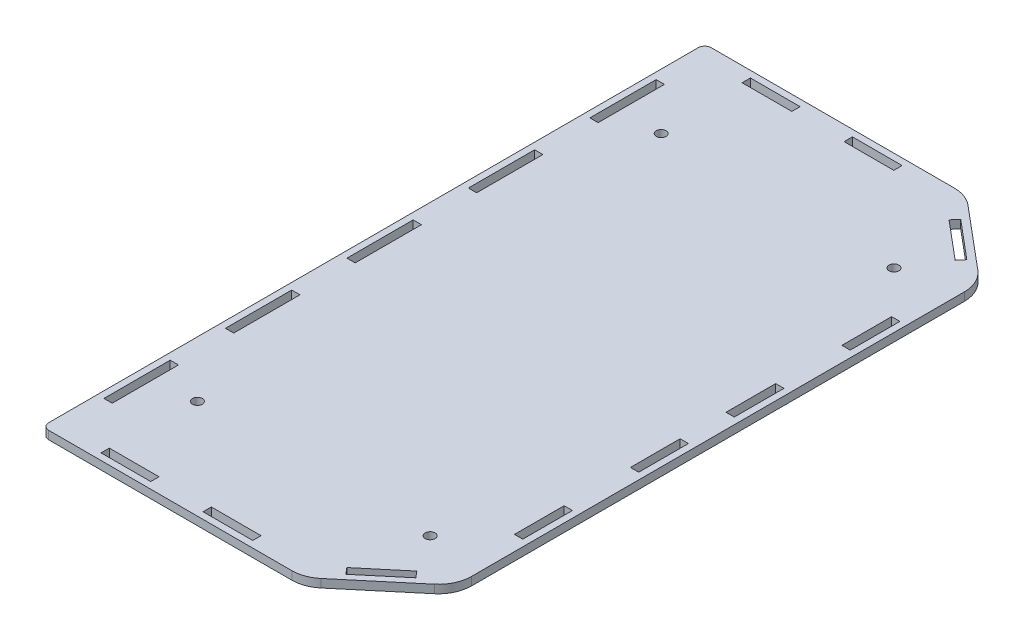
from build123d import *

# Parameters (mm, degrees)
SKETCH1_R           = 1.5
SKETCH1_W           = 15
SKETCH1_H           = 2.5
SKETCH1_W_2         = 2.5
SKETCH1_H_2         = 15
SKETCH1_H_3         = 20
BOSS_EXTRUDE1_DEPTH = 1.25
FILLET1_R           = 10
FILLET2_R           = 2


with BuildPart() as part:
    # Sketch1 → Boss-Extrude1 (new, symmetric)
    with BuildSketch(Plane(origin=(0, 0, 0), x_dir=(1, 0, 0), z_dir=(0, 1, 0))):
        Polygon((-52, -100), (27, -100), (52, -79.022509221), (52, 79.022509221), (27, 100), (-52, 100), align=None)
        with Locations(Location((35.127158073, -70, 0), (0, 0, 270))):
            Circle(SKETCH1_R, mode=Mode.SUBTRACT)
        with Locations(Location((35.127158073, 70, 0), (0, 0, 270))):
            Circle(SKETCH1_R, mode=Mode.SUBTRACT)
        with Locations(Location((-35.127158073, 70, 0), (0, 0, 270))):
            Circle(SKETCH1_R, mode=Mode.SUBTRACT)
        with Locations(Location((-35.127158073, -70, 0), (0, 0, 270))):
            Circle(SKETCH1_R, mode=Mode.SUBTRACT)
        with Locations((-28.71, -96.75)):
            Rectangle(SKETCH1_W, SKETCH1_H, mode=Mode.SUBTRACT)
        with Locations((2.08, -96.75)):
            Rectangle(SKETCH1_W, SKETCH1_H, mode=Mode.SUBTRACT)
        with Locations((-28.71, 96.75)):
            Rectangle(SKETCH1_W, SKETCH1_H, mode=Mode.SUBTRACT)
        with Locations((2.08, 96.75)):
            Rectangle(SKETCH1_W, SKETCH1_H, mode=Mode.SUBTRACT)
        Polygon((30.862122433, -90.884961689), (32.469091457, -92.800072797), (43.959758104, -83.158258651), (42.35278908, -81.243147544), align=None, mode=Mode.SUBTRACT)
        with Locations((48.75, 14.424124759)):
            Rectangle(SKETCH1_W_2, SKETCH1_H_2, mode=Mode.SUBTRACT)
        with Locations((48.75, -49.424124759)):
            Rectangle(SKETCH1_W_2, SKETCH1_H_2, mode=Mode.SUBTRACT)
        with Locations((48.75, -14.424124759)):
            Rectangle(SKETCH1_W_2, SKETCH1_H_2, mode=Mode.SUBTRACT)
        with Locations((48.75, 49.424124759)):
            Rectangle(SKETCH1_W_2, SKETCH1_H_2, mode=Mode.SUBTRACT)
        Polygon((42.35278908, 81.243147544), (30.862122433, 90.884961689), (32.469091457, 92.800072797), (43.959758104, 83.158258651), align=None, mode=Mode.SUBTRACT)
        with Locations((-48.75, -36.666666667)):
            Rectangle(SKETCH1_W_2, SKETCH1_H_3, mode=Mode.SUBTRACT)
        with Locations((-48.75, -73.333333333)):
            Rectangle(SKETCH1_W_2, SKETCH1_H_3, mode=Mode.SUBTRACT)
        with Locations((-48.75, 0)):
            Rectangle(SKETCH1_W_2, SKETCH1_H_3, mode=Mode.SUBTRACT)
        with Locations((-48.75, 36.666666667)):
            Rectangle(SKETCH1_W_2, SKETCH1_H_3, mode=Mode.SUBTRACT)
        with Locations((-48.75, 73.333333333)):
            Rectangle(SKETCH1_W_2, SKETCH1_H_3, mode=Mode.SUBTRACT)
    extrude(amount=BOSS_EXTRUDE1_DEPTH, both=True)

    # Fillet1
    fillet1_edges = [part.edges().sort_by_distance(p)[0] for p in [
        (27, 0, -100),
        (52, 0, -79.022509221),
        (52, 0, 79.022509221),
        (27, 0, 100),
    ]]
    fillet(fillet1_edges, radius=FILLET1_R)

    # Fillet2
    fillet2_edges = [part.edges().sort_by_distance(p)[0] for p in [
        (-52, 0, 100),
        (-52, 0, -100),
    ]]
    fillet(fillet2_edges, radius=FILLET2_R)


solid = part.part
